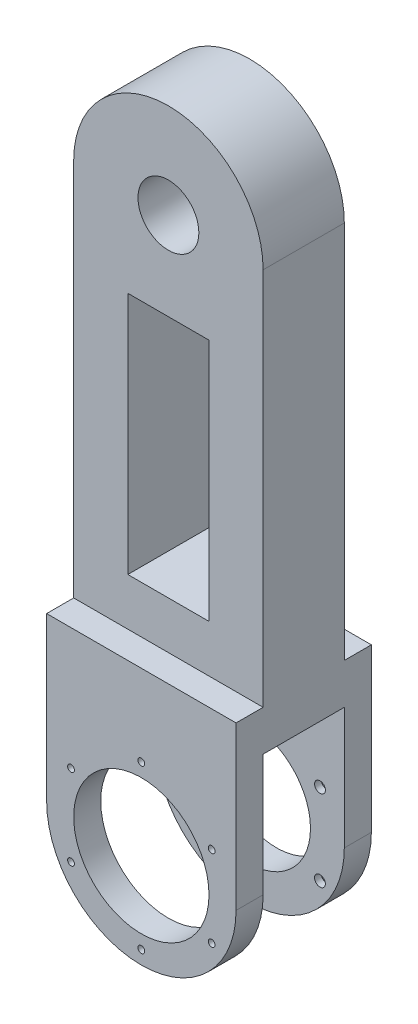
from build123d import *

# Parameters (mm, degrees)
SKETCH_1_W           = 140
SKETCH_1_H           = 350
EXTRUDE_1_DEPTH      = 60
CUT_EXTRUDE_1_REACH  = 199.8
SKETCH_4_W           = 140
SKETCH_4_H           = 100
EXTRUDE_3_DEPTH      = 30
SKETCH_5_W           = 140
SKETCH_5_H           = 20
EXTRUDE_4_DEPTH      = 160
CUT_EXTRUDE_3_DEPTH  = 385.870107959
SKETCH_8_W           = 60
SKETCH_8_H           = 180
CUT_EXTRUDE_4_DEPTH  = 381.164438105
CUT_EXTRUDE_5_REACH  = 386.87
SKETCH_9_R           = 45
CUT_EXTRUDE_6_REACH  = 386.87
SKETCH_10_R          = 50
SKETCH_11_W          = 20
SKETCH_11_H          = 20
CUT_EXTRUDE_7_DEPTH  = 381.164438105
CUT_EXTRUDE_10_REACH = 386.87
SKETCH_13_R          = 2.5
SKETCH_14_R          = 4
CUT_EXTRUDE_11_DEPTH = 5
SKETCH_16_R          = 22.5
SKETCH_16_W          = 20
SKETCH_16_H          = 20
CUT_EXTRUDE_12_DEPTH = 50
SKETCH_17_R          = 1.5
CUT_EXTRUDE_13_DEPTH = 379.186461947
SKETCH_18_R          = 4
CUT_EXTRUDE_14_DEPTH = 5
SKETCH_19_R          = 2.5
CUT_EXTRUDE_15_DEPTH = 385.870107959
CUT_EXTRUDE_START    = -5
SKETCH_20_R          = 4
CUT_EXTRUDE_16_DEPTH = 5


with BuildPart() as part:
    # 草图1 → 凸台-拉伸1 (new body)
    with BuildSketch(Plane.XY):
        Rectangle(SKETCH_1_W, SKETCH_1_H)
    extrude(amount=EXTRUDE_1_DEPTH)

    # 草图2 → 切除-拉伸1 (cut, up to next)
    with BuildSketch(Plane.XY.offset(60), mode=Mode.PRIVATE) as cut_extrude_1_sk1:
        with BuildLine():
            Line((-1.55e-07, 175), (-70, 175))
            Line((-70, 175), (-70, 105))
            ThreePointArc((-70, 105), (-49.497474738, 154.497474628), (-1.55e-07, 175))
        make_face()
    cut_extrude_1_tool1 = extrude(cut_extrude_1_sk1.sketch, amount=-CUT_EXTRUDE_1_REACH, mode=Mode.PRIVATE) & part.part
    # 草图2 → 切除-拉伸1 (cut, up to next)
    with BuildSketch(Plane.XY.offset(60), mode=Mode.PRIVATE) as cut_extrude_1_sk2:
        with BuildLine():
            Line((70, 175), (-1.55e-07, 175))
            ThreePointArc((-1.55e-07, 175), (49.497474628, 154.497474738), (70, 105))
            Line((70, 105), (70, 175))
        make_face()
    cut_extrude_1_tool2 = extrude(cut_extrude_1_sk2.sketch, amount=-CUT_EXTRUDE_1_REACH, mode=Mode.PRIVATE) & part.part
    add(cut_extrude_1_tool1.solids().sort_by_distance((-54.364244, 159.364244, 60))[0], mode=Mode.SUBTRACT)
    add(cut_extrude_1_tool2.solids().sort_by_distance((54.364244, 159.364244, 60))[0], mode=Mode.SUBTRACT)

    # 草图4 → 凸台-拉伸3 (add)
    with BuildSketch(Plane.XZ.offset(175)):
        with Locations((0, 30)):
            Rectangle(SKETCH_4_W, SKETCH_4_H)
    extrude(amount=EXTRUDE_3_DEPTH)

    # 草图5 → 凸台-拉伸4 (add)
    with BuildSketch(Plane.XZ.offset(205)):
        with Locations((0, 70)):
            Rectangle(SKETCH_5_W, SKETCH_5_H)
        with Locations((0, -10)):
            Rectangle(SKETCH_5_W, SKETCH_5_H)
    extrude(amount=EXTRUDE_4_DEPTH)

    # 草图7 → 切除-拉伸3 (cut, through all)
    with BuildSketch(Plane(origin=(0, 0, -20), x_dir=(-1, 0, 0), z_dir=(0, 0, -1))):
        with BuildLine():
            Line((-70, -295), (-70, -365))
            Line((-70, -365), (0, -365))
            ThreePointArc((0, -365), (-49.497474683, -344.497474683), (-70, -295))
        make_face()
        with BuildLine():
            ThreePointArc((70, -295), (49.497474683, -344.497474683), (0, -365))
            Line((0, -365), (70, -365))
            Line((70, -365), (70, -295))
        make_face()
    extrude(amount=-CUT_EXTRUDE_3_DEPTH, mode=Mode.SUBTRACT)

    # 草图8 → 切除-拉伸4 (cut, through all)
    with BuildSketch(Plane(origin=(0, 0, 0), x_dir=(-1, 0, 0), z_dir=(0, 0, -1))):
        with Locations((0, -50)):
            Rectangle(SKETCH_8_W, SKETCH_8_H)
    extrude(amount=-CUT_EXTRUDE_4_DEPTH, mode=Mode.SUBTRACT)

    # 草图9 → 切除-拉伸5 (cut, up to next)
    with BuildSketch(Plane(origin=(0, 0, -20), x_dir=(-1, 0, 0), z_dir=(0, 0, -1)), mode=Mode.PRIVATE) as cut_extrude_5_sk1:
        with Locations((0, -295)):
            Circle(SKETCH_9_R)
    cut_extrude_5_tool1 = extrude(cut_extrude_5_sk1.sketch, amount=-CUT_EXTRUDE_5_REACH, mode=Mode.PRIVATE) & part.part
    add(cut_extrude_5_tool1.solids().sort_by_distance((0, -295, -20))[0], mode=Mode.SUBTRACT)

    # 草图10 → 切除-拉伸6 (cut, up to next)
    with BuildSketch(Plane.XY.offset(80), mode=Mode.PRIVATE) as cut_extrude_6_sk1:
        with Locations((0, -295)):
            Circle(SKETCH_10_R)
    cut_extrude_6_tool1 = extrude(cut_extrude_6_sk1.sketch, amount=-CUT_EXTRUDE_6_REACH, mode=Mode.PRIVATE) & part.part
    add(cut_extrude_6_tool1.solids().sort_by_distance((0, -295, 80))[0], mode=Mode.SUBTRACT)

    # 草图11 → 切除-拉伸7 (cut, through all)
    with BuildSketch(Plane.XY.offset(60)):
        with Locations((0, 105)):
            Rectangle(SKETCH_11_W, SKETCH_11_H)
    extrude(amount=-CUT_EXTRUDE_7_DEPTH, mode=Mode.SUBTRACT)

    # 草图13 → 切除-拉伸10 (cut, up to next)
    with BuildSketch(Plane.XY.offset(80), mode=Mode.PRIVATE) as cut_extrude_10_sk1:
        with Locations((-51.961524227, -265)):
            Circle(SKETCH_13_R)
    cut_extrude_10_tool1 = extrude(cut_extrude_10_sk1.sketch, amount=-CUT_EXTRUDE_10_REACH, mode=Mode.PRIVATE) & part.part
    # 草图13 → 切除-拉伸10 (cut, up to next)
    with BuildSketch(Plane.XY.offset(80), mode=Mode.PRIVATE) as cut_extrude_10_sk2:
        with Locations((0, -235)):
            Circle(SKETCH_13_R)
    cut_extrude_10_tool2 = extrude(cut_extrude_10_sk2.sketch, amount=-CUT_EXTRUDE_10_REACH, mode=Mode.PRIVATE) & part.part
    # 草图13 → 切除-拉伸10 (cut, up to next)
    with BuildSketch(Plane.XY.offset(80), mode=Mode.PRIVATE) as cut_extrude_10_sk3:
        with Locations((51.961524227, -265)):
            Circle(SKETCH_13_R)
    cut_extrude_10_tool3 = extrude(cut_extrude_10_sk3.sketch, amount=-CUT_EXTRUDE_10_REACH, mode=Mode.PRIVATE) & part.part
    # 草图13 → 切除-拉伸10 (cut, up to next)
    with BuildSketch(Plane.XY.offset(80), mode=Mode.PRIVATE) as cut_extrude_10_sk4:
        with Locations((51.961524227, -325)):
            Circle(SKETCH_13_R)
    cut_extrude_10_tool4 = extrude(cut_extrude_10_sk4.sketch, amount=-CUT_EXTRUDE_10_REACH, mode=Mode.PRIVATE) & part.part
    # 草图13 → 切除-拉伸10 (cut, up to next)
    with BuildSketch(Plane.XY.offset(80), mode=Mode.PRIVATE) as cut_extrude_10_sk5:
        with Locations((0, -355)):
            Circle(SKETCH_13_R)
    cut_extrude_10_tool5 = extrude(cut_extrude_10_sk5.sketch, amount=-CUT_EXTRUDE_10_REACH, mode=Mode.PRIVATE) & part.part
    # 草图13 → 切除-拉伸10 (cut, up to next)
    with BuildSketch(Plane.XY.offset(80), mode=Mode.PRIVATE) as cut_extrude_10_sk6:
        with Locations((-51.961524227, -325)):
            Circle(SKETCH_13_R)
    cut_extrude_10_tool6 = extrude(cut_extrude_10_sk6.sketch, amount=-CUT_EXTRUDE_10_REACH, mode=Mode.PRIVATE) & part.part
    add(cut_extrude_10_tool1.solids().sort_by_distance((-51.961524, -265, 80))[0], mode=Mode.SUBTRACT)
    add(cut_extrude_10_tool2.solids().sort_by_distance((0, -235, 80))[0], mode=Mode.SUBTRACT)
    add(cut_extrude_10_tool3.solids().sort_by_distance((51.961524, -265, 80))[0], mode=Mode.SUBTRACT)
    add(cut_extrude_10_tool4.solids().sort_by_distance((51.961524, -325, 80))[0], mode=Mode.SUBTRACT)
    add(cut_extrude_10_tool5.solids().sort_by_distance((0, -355, 80))[0], mode=Mode.SUBTRACT)
    add(cut_extrude_10_tool6.solids().sort_by_distance((-51.961524, -325, 80))[0], mode=Mode.SUBTRACT)

    # 草图14 → 切除-拉伸11 (cut)
    with BuildSketch(Plane(origin=(0, 0, 60), x_dir=(-1, 0, 0), z_dir=(0, 0, -1))):
        with Locations((-51.961524227, -325)):
            Circle(SKETCH_14_R)
        with Locations((-51.961524227, -265)):
            Circle(SKETCH_14_R)
        with Locations((0, -235)):
            Circle(SKETCH_14_R)
        with Locations((51.961524227, -265)):
            Circle(SKETCH_14_R)
        with Locations((51.961524227, -325)):
            Circle(SKETCH_14_R)
        with Locations((0, -355)):
            Circle(SKETCH_14_R)
    extrude(amount=-CUT_EXTRUDE_11_DEPTH, mode=Mode.SUBTRACT)

    # 草图16 → 切除-拉伸12 (cut)
    with BuildSketch(Plane.XY.offset(60)):
        with Locations((0, 105)):
            Circle(SKETCH_16_R)
        with Locations((0, 105)):
            Rectangle(SKETCH_16_W, SKETCH_16_H, mode=Mode.SUBTRACT)
    extrude(amount=-CUT_EXTRUDE_12_DEPTH, mode=Mode.SUBTRACT)

    # 草图17 → 切除-拉伸13 (cut, through all)
    with BuildSketch(Plane.XY.offset(10)):
        with Locations((0, 122.5)):
            Circle(SKETCH_17_R)
        with Locations((15.155444566, 113.75)):
            Circle(SKETCH_17_R)
        with Locations((15.155444566, 96.25)):
            Circle(SKETCH_17_R)
        with Locations((0, 87.5)):
            Circle(SKETCH_17_R)
        with Locations((-15.155444566, 96.25)):
            Circle(SKETCH_17_R)
        with Locations((-15.155444566, 113.75)):
            Circle(SKETCH_17_R)
    extrude(amount=-CUT_EXTRUDE_13_DEPTH, mode=Mode.SUBTRACT)

    # 草图18 → 切除-拉伸14 (cut)
    with BuildSketch(Plane(origin=(0, 0, -20), x_dir=(-1, 0, 0), z_dir=(0, 0, -1))):
        with Locations((0, -235)):
            Circle(SKETCH_18_R)
        with Locations((-51.961524227, -265)):
            Circle(SKETCH_18_R)
        with Locations((-51.961524227, -325)):
            Circle(SKETCH_18_R)
        with Locations((0, -355)):
            Circle(SKETCH_18_R)
        with Locations((51.961524227, -325)):
            Circle(SKETCH_18_R)
        with Locations((51.961524227, -265)):
            Circle(SKETCH_18_R)
    extrude(amount=-CUT_EXTRUDE_14_DEPTH, mode=Mode.SUBTRACT)

    # 草图19 → 切除-拉伸15 (cut, through all)
    with BuildSketch(Plane(origin=(0, 0, -20), x_dir=(-1, 0, 0), z_dir=(0, 0, -1))):
        with Locations(Location((-51.961524227, -265, 0), (0, 0, 180))):
            Circle(SKETCH_19_R)
        with Locations(Location((-51.961524227, -325, 0), (0, 0, 180))):
            Circle(SKETCH_19_R)
        with Locations(Location((0, -355, 0), (0, 0, 180))):
            Circle(SKETCH_19_R)
        with Locations(Location((51.961524227, -325, 0), (0, 0, 180))):
            Circle(SKETCH_19_R)
        with Locations(Location((51.961524227, -265, 0), (0, 0, 180))):
            Circle(SKETCH_19_R)
        with Locations(Location((0, -235, 0), (0, 0, 180))):
            Circle(SKETCH_19_R)
    extrude(amount=-CUT_EXTRUDE_15_DEPTH, mode=Mode.SUBTRACT)

    # 草图20 → 切除-拉伸16 (cut)
    with BuildSketch(Plane.XY.offset(CUT_EXTRUDE_START)):
        with Locations(Location((-51.961524227, -265, 0), (0, 0, 180))):
            Circle(SKETCH_20_R)
        with Locations((0.040572827, -234.996244649)):
            Circle(SKETCH_20_R)
        with Locations((52.025635698, -265.029504072)):
            Circle(SKETCH_20_R)
        with Locations((52.008601514, -325.066518847)):
            Circle(SKETCH_20_R)
        with Locations((0.00650446, -355.070274198)):
            Circle(SKETCH_20_R)
        with Locations((-51.978558411, -325.037014775)):
            Circle(SKETCH_20_R)
    extrude(amount=CUT_EXTRUDE_16_DEPTH, mode=Mode.SUBTRACT)


solid = part.part
